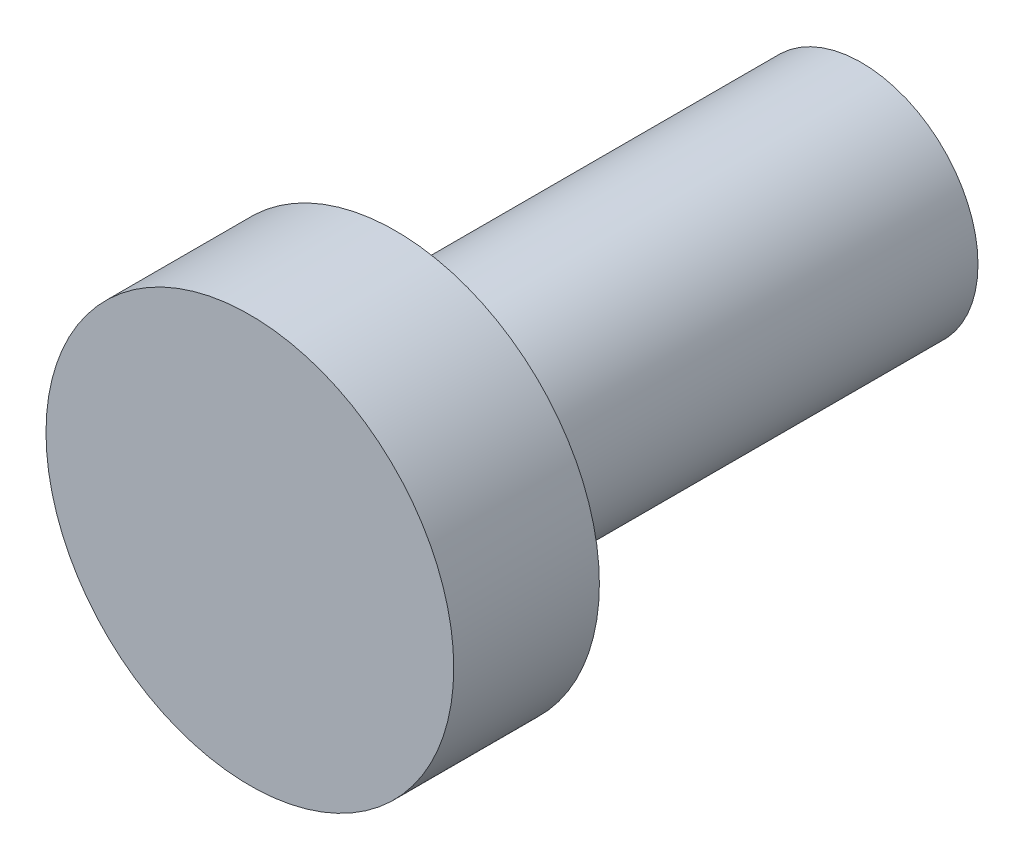
from build123d import *

# Parameters (mm, degrees)
SKETCH1_R           = 2
BOSS_EXTRUDE1_DEPTH = 8
SKETCH2_R           = 3.5
BOSS_EXTRUDE2_DEPTH = 2.5


with BuildPart() as part:
    # Sketch1 → Boss-Extrude1 (new body)
    with BuildSketch(Plane.XY):
        Circle(SKETCH1_R)
    extrude(amount=-BOSS_EXTRUDE1_DEPTH)

    # Sketch2 → Boss-Extrude2 (add)
    with BuildSketch(Plane.XY):
        Circle(SKETCH2_R)
    extrude(amount=BOSS_EXTRUDE2_DEPTH)


solid = part.part
